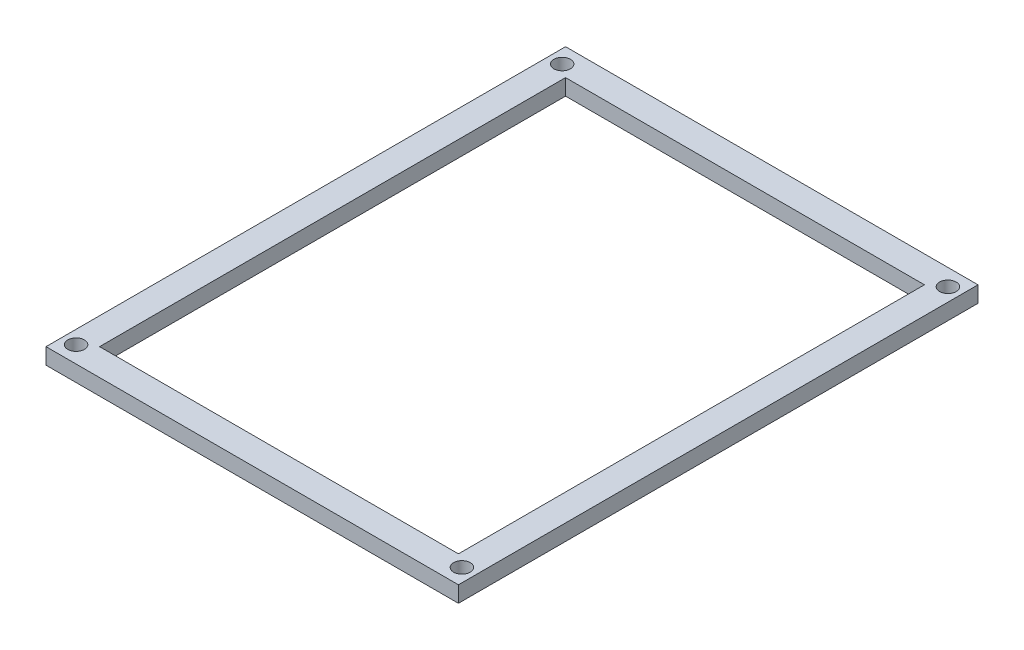
from build123d import *

# Parameters (mm, degrees)
SKETCH1_W           = 77
SKETCH1_H           = 97
SKETCH1_R           = 1.55
SKETCH1_W_2         = 67
SKETCH1_H_2         = 87
BOSS_EXTRUDE1_DEPTH = 3


with BuildPart() as part:
    # Sketch1 → Boss-Extrude1 (new body)
    with BuildSketch(Plane(origin=(0, 0, 0), x_dir=(1, 0, 0), z_dir=(0, 1, 0))):
        with Locations((33.5, 43.5)):
            Rectangle(SKETCH1_W, SKETCH1_H)
        with Locations(Location((69.513054032, 88.86709404, 0), (0, 0, 270))):
            Circle(SKETCH1_R, mode=Mode.SUBTRACT)
        with Locations(Location((-2.513054032, 88.86709404, 0), (0, 0, 270))):
            Circle(SKETCH1_R, mode=Mode.SUBTRACT)
        with Locations(Location((-2.513054032, -1.86709404, 0), (0, 0, 270))):
            Circle(SKETCH1_R, mode=Mode.SUBTRACT)
        with Locations(Location((69.513054032, -1.86709404, 0), (0, 0, 270))):
            Circle(SKETCH1_R, mode=Mode.SUBTRACT)
        with Locations((33.5, 43.5)):
            Rectangle(SKETCH1_W_2, SKETCH1_H_2, mode=Mode.SUBTRACT)
    extrude(amount=BOSS_EXTRUDE1_DEPTH)


solid = part.part
